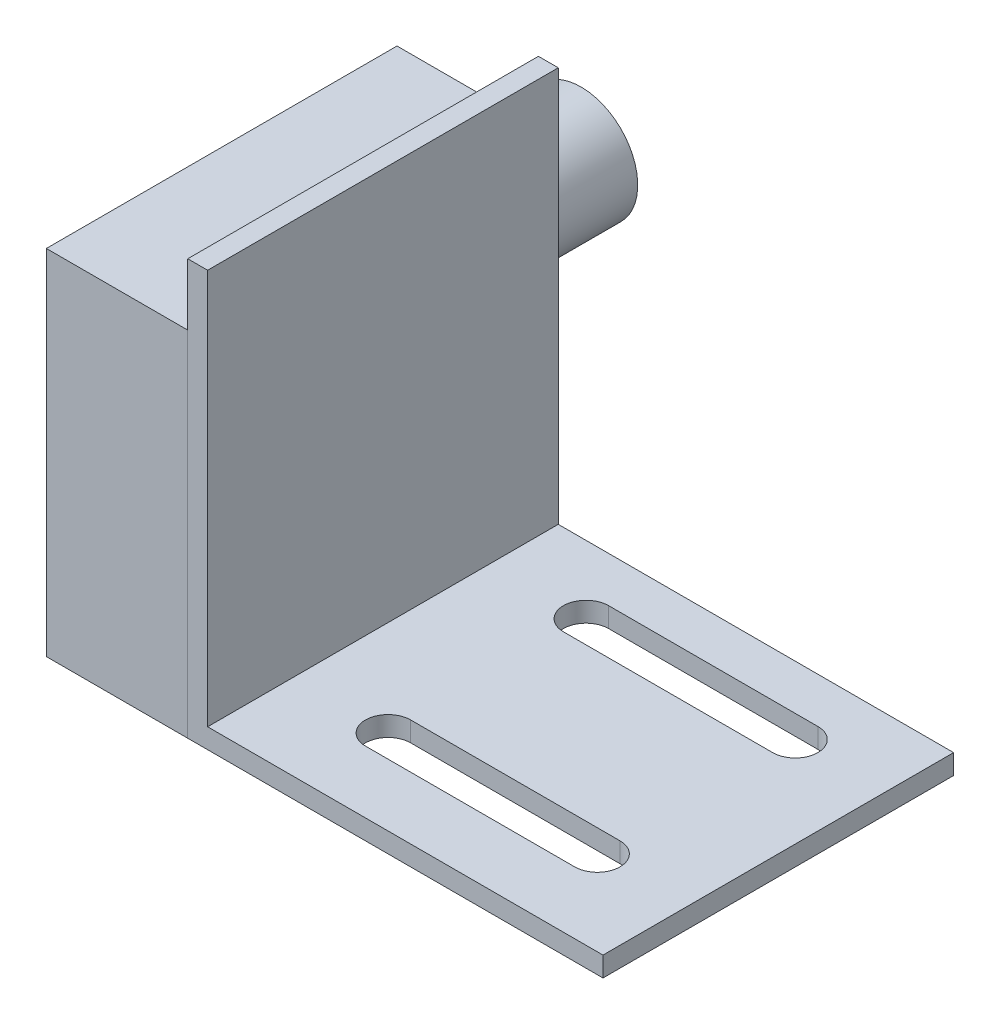
from build123d import *

# Parameters (mm, degrees)
BOSS_EXTRUDE1_DEPTH = 15.748
SKETCH2_W           = 31.496
SKETCH2_H           = 31.75
BOSS_EXTRUDE2_DEPTH = 12.7
SKETCH4_R           = 5.08
BOSS_EXTRUDE3_DEPTH = 10.16
CUT_EXTRUDE1_DEPTH  = 58.650589979
LPATTERN1_COUNT     = 2
LPATTERN1_PITCH     = 17.78


with BuildPart() as part:
    # Sketch1 → Boss-Extrude1 (new, symmetric)
    with BuildSketch(Plane.XY):
        Polygon((0, 0), (0, 37.298312705), (1.784907768, 37.298312705), (1.784907768, 1.784907768), (37.298312705, 1.784907768), (37.298312705, 0), align=None)
    extrude(amount=BOSS_EXTRUDE1_DEPTH, both=True)

    # Sketch6 → Cut-Extrude1 (cut, through all)
    with BuildSketch(Plane(origin=(0, 1.784907768, 0), x_dir=(1, 0, 0), z_dir=(0, 1, 0))):
        with BuildLine():
            Line((29.170312705, 11.684), (10.374312705, 11.684))
            ThreePointArc((10.374312705, 11.684), (8.342312705, 9.652), (10.374312705, 7.62))
            Line((10.374312705, 7.62), (29.170312705, 7.62))
            ThreePointArc((29.170312705, 7.62), (31.202312705, 9.652), (29.170312705, 11.684))
        make_face()
    cut_extrude1 = extrude(amount=-CUT_EXTRUDE1_DEPTH, mode=Mode.SUBTRACT)

    # LPattern1: Cut-Extrude1 ×2
    with Locations(*[(0, 0, i * LPATTERN1_PITCH) for i in range(1, LPATTERN1_COUNT)]):
        add(cut_extrude1, mode=Mode.SUBTRACT)


with BuildPart() as body_2:
    # Sketch2 → Boss-Extrude2 (new body)
    with BuildSketch(Plane.ZY):
        with Locations((0, 15.875)):
            Rectangle(SKETCH2_W, SKETCH2_H)
    extrude(amount=BOSS_EXTRUDE2_DEPTH)

    # Sketch4 → Boss-Extrude3 (add)
    with BuildSketch(Plane(origin=(0, 0, -15.748), x_dir=(-1, 0, 0), z_dir=(0, 0, -1))):
        with Locations((6.320909995, 21.59)):
            Circle(SKETCH4_R)
    extrude(amount=BOSS_EXTRUDE3_DEPTH)


solid = Compound([part.part, body_2.part])
